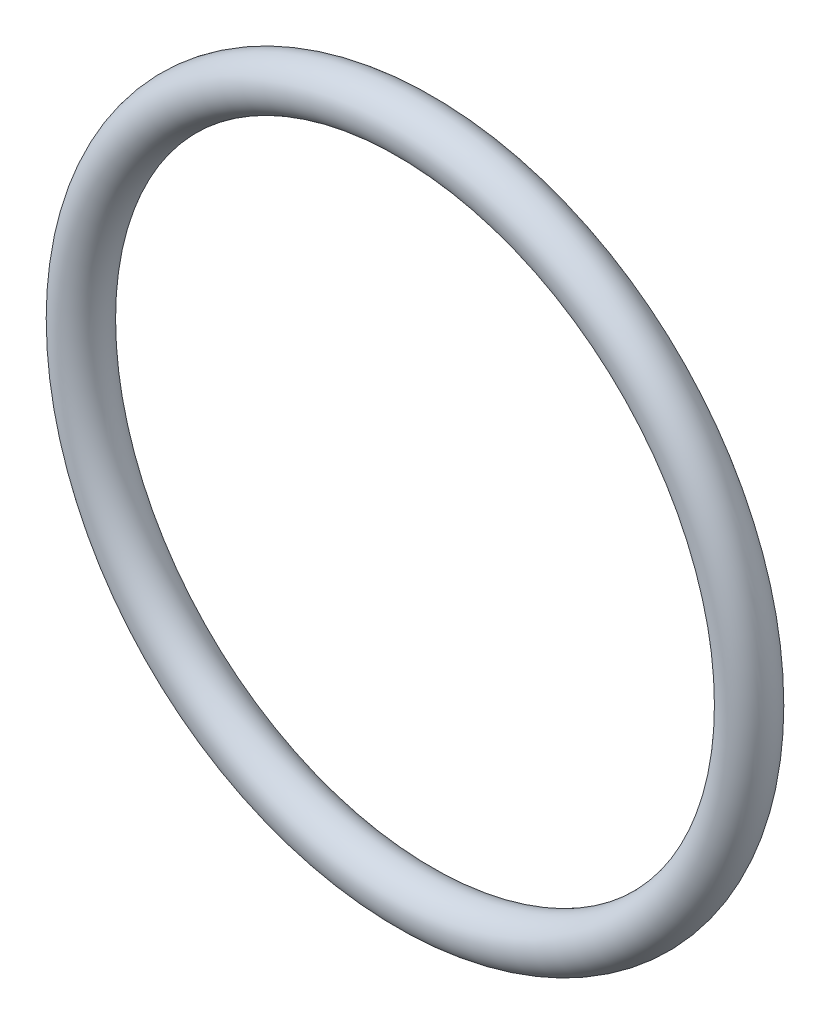
from build123d import *

# Parameters (mm, degrees)
SKETCH1_R = 1.3081


with BuildPart() as part:
    # Sketch1 → Revolve1 (revolve)
    with BuildSketch(Plane(origin=(0, 0, 0), x_dir=(0, -1, 0), z_dir=(1, 0, 0))):
        with Locations((17.8054, 0)):
            Circle(SKETCH1_R)
    revolve(axis=Axis((0, 0, 1.3081), (0, 0, -1)))


solid = part.part
